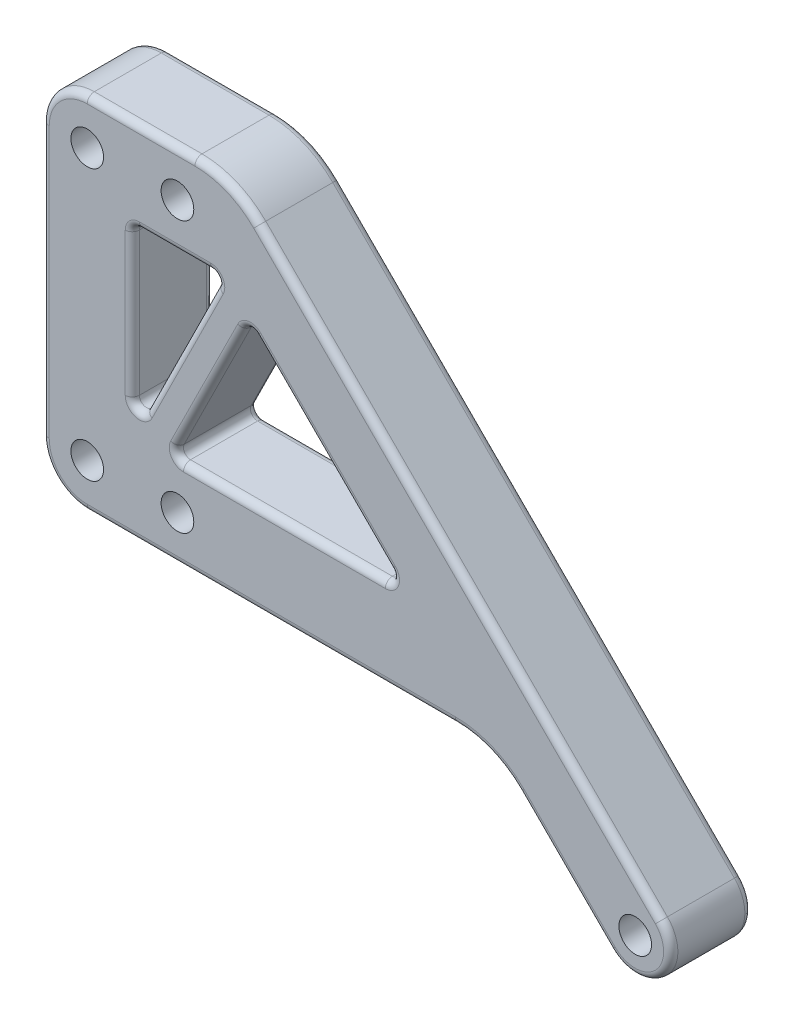
from build123d import *

# Parameters (mm, degrees)
SKETCH1_R           = 2.3
BOSS_EXTRUDE1_DEPTH = 11.43
FILLET2_R           = 1
FILLET3_R           = 6.35
FILLET4_R           = 12.7
FILLET5_R           = 1


with BuildPart() as part:
    # Sketch1 → Boss-Extrude1 (new body)
    with BuildSketch(Plane.XY):
        with BuildLine():
            Line((-56.728932188, 63.8), (-83.5, 63.8))
            Line((-83.5, 63.8), (-83.5, 13))
            Line((-83.5, 13), (-20.071067812, 13))
            Line((-20.071067812, 13), (-3.535533906, -3.535533906))
            ThreePointArc((-3.535533906, -3.535533906), (3.535533906, -3.535533906), (3.535533906, 3.535533906))
            Line((3.535533906, 3.535533906), (-56.728932188, 63.8))
        make_face()
        with Locations((-77.15, 19.35)):
            Circle(SKETCH1_R, mode=Mode.SUBTRACT)
        with Locations((-64.45, 19.35)):
            Circle(SKETCH1_R, mode=Mode.SUBTRACT)
        Circle(SKETCH1_R, mode=Mode.SUBTRACT)
        Polygon((-32.771067812, 25.7), (-65.216072433, 25.7), (-54.441492669, 47.370424857), align=None, mode=Mode.SUBTRACT)
        Polygon((-70.8, 51.1), (-58.171067812, 51.1), (-70.8, 25.7), align=None, mode=Mode.SUBTRACT)
        with Locations((-77.15, 57.45)):
            Circle(SKETCH1_R, mode=Mode.SUBTRACT)
        with Locations((-64.45, 57.45)):
            Circle(SKETCH1_R, mode=Mode.SUBTRACT)
    extrude(amount=BOSS_EXTRUDE1_DEPTH)

    # Fillet2
    fillet2_edges = [part.edges().sort_by_distance(p)[0] for p in [
        (-65.216072433, 25.7, 5.715),
        (-32.771067812, 25.7, 5.715),
        (-54.441492669, 47.370424857, 5.715),
        (-70.8, 51.1, 5.715),
        (-70.8, 25.7, 5.715),
        (-58.171067812, 51.1, 5.715),
    ]]
    fillet(fillet2_edges, radius=FILLET2_R)

    # Fillet3
    fillet3_edges = [part.edges().sort_by_distance(p)[0] for p in [
        (-83.5, 13, 5.715),
        (-83.5, 63.8, 5.715),
    ]]
    fillet(fillet3_edges, radius=FILLET3_R)

    # Fillet4
    fillet4_edges = [part.edges().sort_by_distance(p)[0] for p in [
        (-20.071067812, 13, 5.715),
        (-56.728932188, 63.8, 5.715),
    ]]
    fillet(fillet4_edges, radius=FILLET4_R)

    # Fillet5
    fillet5_edges = [part.edges().sort_by_distance(p)[0] for p in [
        (-9.943428919, 2.872361108, 0),
        (-9.943428919, 2.872361108, 11.43),
        (-57.129364839, 62.833270063, 0),
        (-57.129364839, 62.833270063, 11.43),
        (-20.471500463, 12.033270063, 0),
        (-20.471500463, 12.033270063, 11.43),
        (-24.736827202, 31.807895014, 0),
        (3.535533906, -3.535533906, 0),
        (-49.393683119, 25.7, 0),
        (-49.393683119, 25.7, 11.43),
        (-43.968144034, 36.897076222, 0),
        (-43.968144034, 36.897076222, 11.43),
        (-59.779079648, 36.635177628, 0),
        (-59.779079648, 36.635177628, 11.43),
        (-70.8, 40.028697472, 0),
        (-70.8, 40.028697472, 11.43),
        (-63.897100602, 39.583489284, 0),
        (-63.897100602, 39.583489284, 11.43),
        (-64.79252769, 51.1, 0),
        (-64.79252769, 51.1, 11.43),
        (-34.261401842, 26.317316568, 0),
        (-34.261401842, 26.317316568, 11.43),
        (-64.452146094, 26.173316123, 0),
        (-64.452146094, 26.173316123, 11.43),
        (-70.028662319, 28.983889143, 0),
        (-70.028662319, 28.983889143, 11.43),
        (-70.507106781, 50.807106781, 0),
        (-70.507106781, 50.807106781, 11.43),
        (-58.934994151, 50.626683877, 0),
        (-58.934994151, 50.626683877, 11.43),
        (-54.32650836, 46.666846246, 0),
        (3.535533906, -3.535533906, 11.43),
        (-54.32650836, 46.666846246, 11.43),
        (-24.736827202, 31.807895014, 11.43),
        (-51.240790027, 13, 0),
        (-51.240790027, 13, 11.43),
        (-83.5, 38.4, 0),
        (-69.569722215, 63.8, 0),
        (-81.640128061, 61.940128061, 0),
        (-81.640128061, 14.859871939, 0),
        (-83.5, 38.4, 11.43),
        (-69.569722215, 63.8, 11.43),
        (-81.640128061, 61.940128061, 11.43),
        (-81.640128061, 14.859871939, 11.43),
    ]]
    fillet(fillet5_edges, radius=FILLET5_R)


solid = part.part
